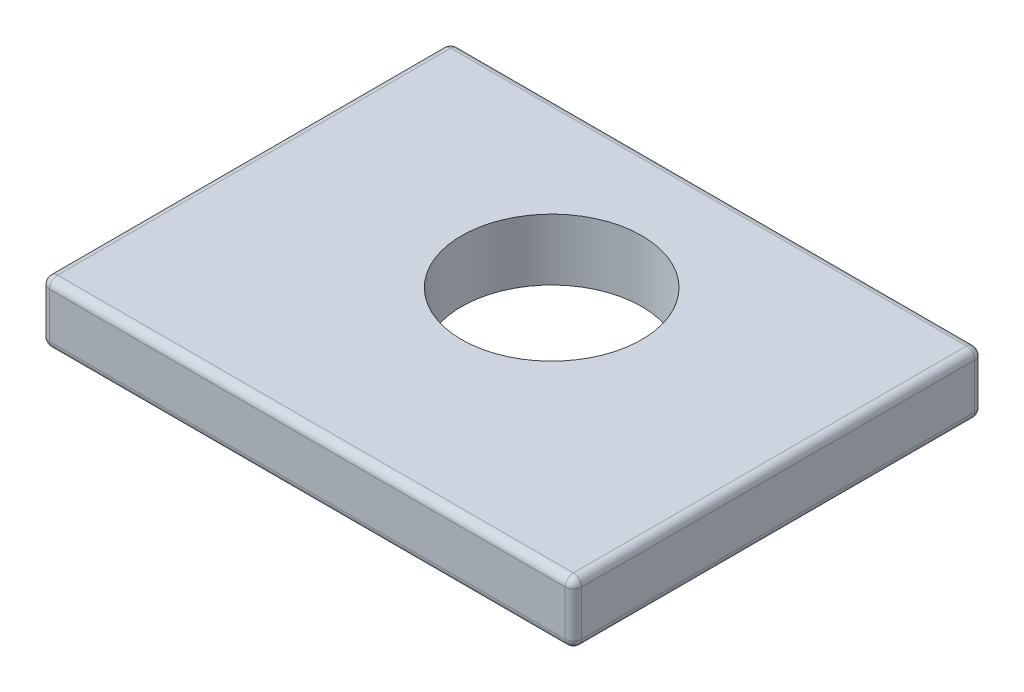
from build123d import *

# Parameters (mm, degrees)
SKETCH1_W           = 6.5
SKETCH1_H           = 5
BOSS_EXTRUDE1_DEPTH = 0.75
SKETCH2_R           = 1.1
CUT_EXTRUDE1_DEPTH  = 5.168333
FILLET1_R           = 0.1


with BuildPart() as part:
    # Sketch1 → Boss-Extrude1 (new body)
    with BuildSketch(Plane(origin=(0, 0, 0), x_dir=(1, 0, 0), z_dir=(0, 1, 0))):
        Rectangle(SKETCH1_W, SKETCH1_H)
    extrude(amount=BOSS_EXTRUDE1_DEPTH)

    # Sketch2 → Cut-Extrude1 (cut, through all)
    with BuildSketch(Plane(origin=(0, 0, 0), x_dir=(1, 0, 0), z_dir=(0, 1, 0))):
        with Locations(Location((0, 0.484711092, 0), (0, 0, 270))):
            Circle(SKETCH2_R)
    extrude(amount=CUT_EXTRUDE1_DEPTH, mode=Mode.SUBTRACT)

    # Fillet1
    fillet1_edges = [part.edges().sort_by_distance(p)[0] for p in [
        (-3.25, 0.75, 0),
        (0, 0.75, 2.5),
        (3.25, 0.75, 0),
        (0, 0, 2.5),
        (-3.25, 0, 0),
        (0, 0, -2.5),
        (3.25, 0, 0),
        (3.25, 0.375, 2.5),
        (-3.25, 0.375, 2.5),
        (-3.25, 0.375, -2.5),
        (3.25, 0.375, -2.5),
        (0, 0.75, -2.5),
    ]]
    fillet(fillet1_edges, radius=FILLET1_R)


solid = part.part
